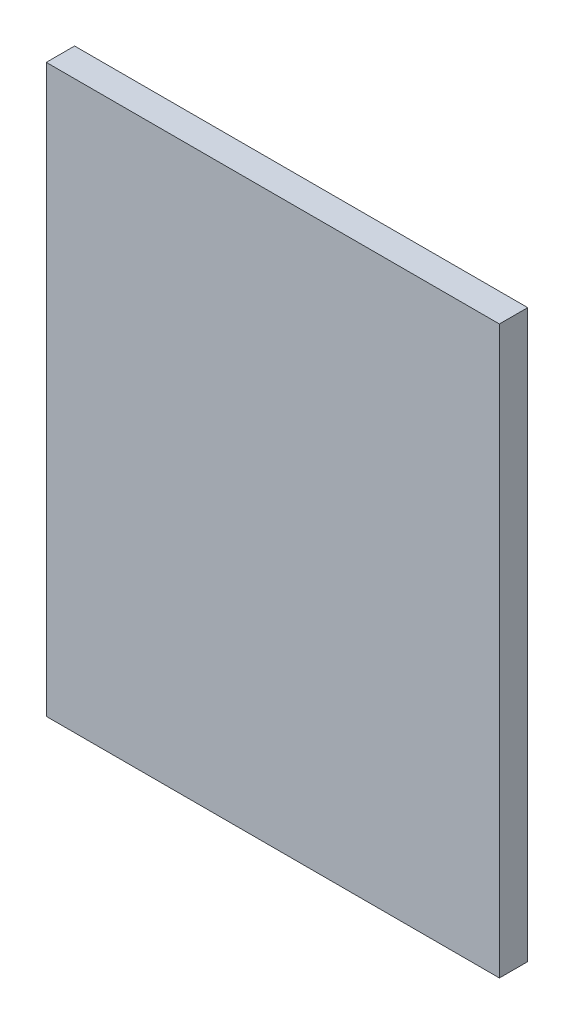
from build123d import *

# Parameters (mm, degrees)
ESQUISSE1_W        = 1.6
ESQUISSE1_H        = 2
BOSS_EXTRU_1_DEPTH = 0.1


with BuildPart() as part:
    # Esquisse1 → Boss.-Extru.1 (new body)
    with BuildSketch(Plane.XY):
        with Locations((-0.8, 1)):
            Rectangle(ESQUISSE1_W, ESQUISSE1_H)
    extrude(amount=BOSS_EXTRU_1_DEPTH)


solid = part.part
